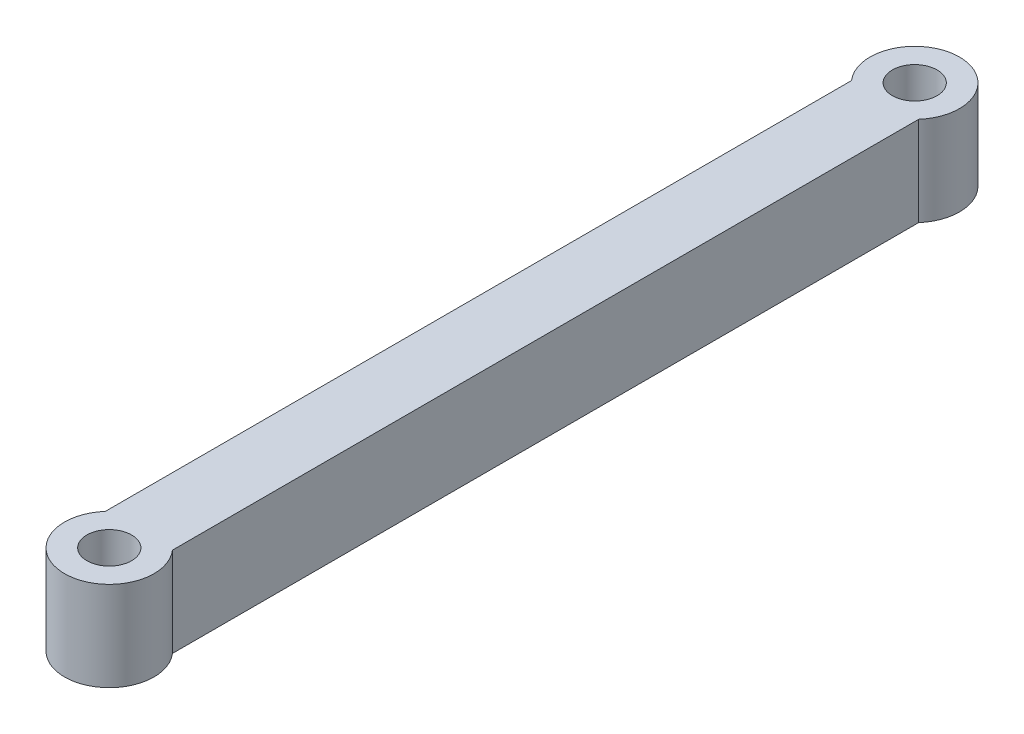
from build123d import *

# Parameters (mm, degrees)
SKETCH1_R           = 2.5
BOSS_EXTRUDE1_DEPTH = 10


with BuildPart() as part:
    # Sketch1 → Boss-Extrude1 (new body)
    with BuildSketch(Plane(origin=(0, 0, 0), x_dir=(1, 0, 0), z_dir=(0, 1, 0))):
        with BuildLine():
            Line((-3.75, 41.692810861), (-3.75, -41.692810861))
            ThreePointArc((-3.75, -41.692810861), (0, -50), (3.75, -41.692810861))
            Line((3.75, -41.692810861), (3.75, 41.692810861))
            ThreePointArc((3.75, 41.692810861), (0, 50), (-3.75, 41.692810861))
        make_face()
        with Locations(Location((0, 45, 0), (0, 0, 270))):
            Circle(SKETCH1_R, mode=Mode.SUBTRACT)
        with Locations(Location((0, -45, 0), (0, 0, 270))):
            Circle(SKETCH1_R, mode=Mode.SUBTRACT)
    extrude(amount=BOSS_EXTRUDE1_DEPTH)


solid = part.part
